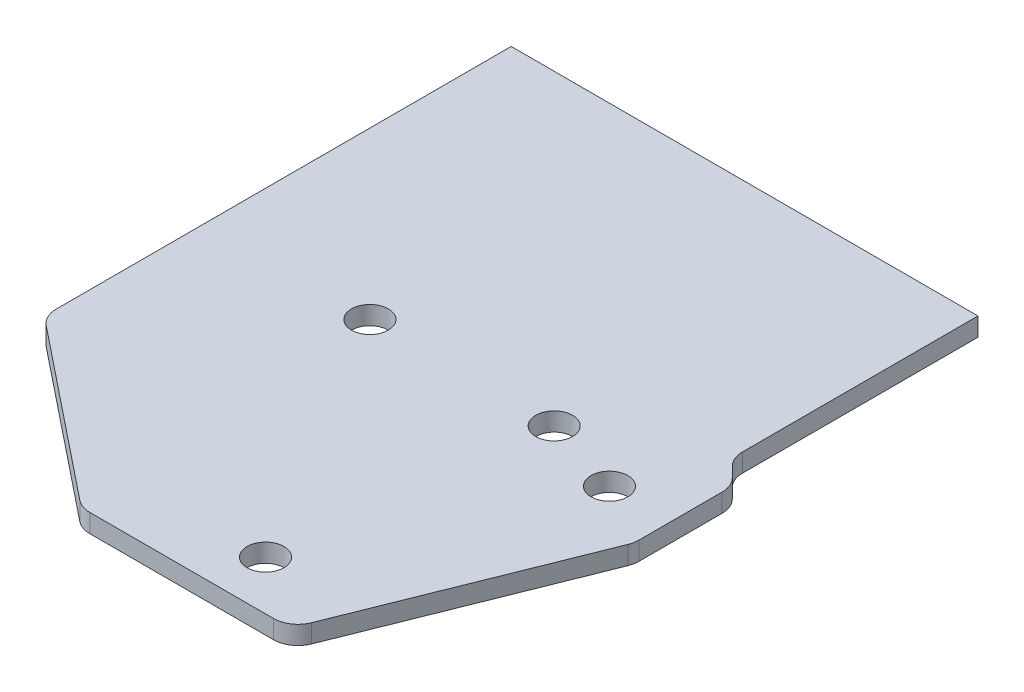
from build123d import *

# Parameters (mm, degrees)
ESBO_O1_R                = 1.5
RESSALTO_EXTRUS_O1_DEPTH = 1.5


with BuildPart() as part:
    # Esboço1 → Ressalto-extrusão1 (new body)
    with BuildSketch(Plane(origin=(0, 0, 0), x_dir=(1, 0, 0), z_dir=(0, 1, 0))):
        with BuildLine():
            Line((-19, 25), (-19, -12.038750305))
            ThreePointArc((-19, -12.038750305), (-18.802606473, -12.905127766), (-18.249390095, -13.600487924))
            Line((-18.249390095, -13.600487924), (-4.547827976, -24.561737619))
            ThreePointArc((-4.547827976, -24.561737619), (-3.960451764, -24.887256638), (-3.298437881, -25))
            Line((-3.298437881, -25), (4.712, -25))
            Line((4.712, -25), (11.645934077, -25))
            ThreePointArc((11.645934077, -25), (12.767191696, -24.656134461), (13.502887459, -23.742781353))
            Line((13.502887459, -23.742781353), (20.856953382, -5.357616546))
            ThreePointArc((20.856953382, -5.357616546), (20.963912773, -4.993050235), (21, -4.614835193))
            Line((21, -4.614835193), (21, 2.171572875))
            ThreePointArc((21, 2.171572875), (20.847759065, 2.93693974), (20.414213562, 3.585786438))
            Line((20.414213562, 3.585786438), (19.585786438, 4.414213562))
            ThreePointArc((19.585786438, 4.414213562), (19.152240935, 5.06306026), (19, 5.828427125))
            Line((19, 5.828427125), (19, 25))
            Line((19, 25), (-19, 25))
        make_face()
        with Locations(Location((7, -21, 0), (0, 0, 270))):
            Circle(ESBO_O1_R, mode=Mode.SUBTRACT)
        with Locations(Location((9.5, 0, 0), (0, 0, 270))):
            Circle(ESBO_O1_R, mode=Mode.SUBTRACT)
        with Locations(Location((16, -2, 0), (0, 0, 270))):
            Circle(ESBO_O1_R, mode=Mode.SUBTRACT)
        with Locations(Location((-5.5, 0, 0), (0, 0, 270))):
            Circle(ESBO_O1_R, mode=Mode.SUBTRACT)
    extrude(amount=RESSALTO_EXTRUS_O1_DEPTH)


solid = part.part
